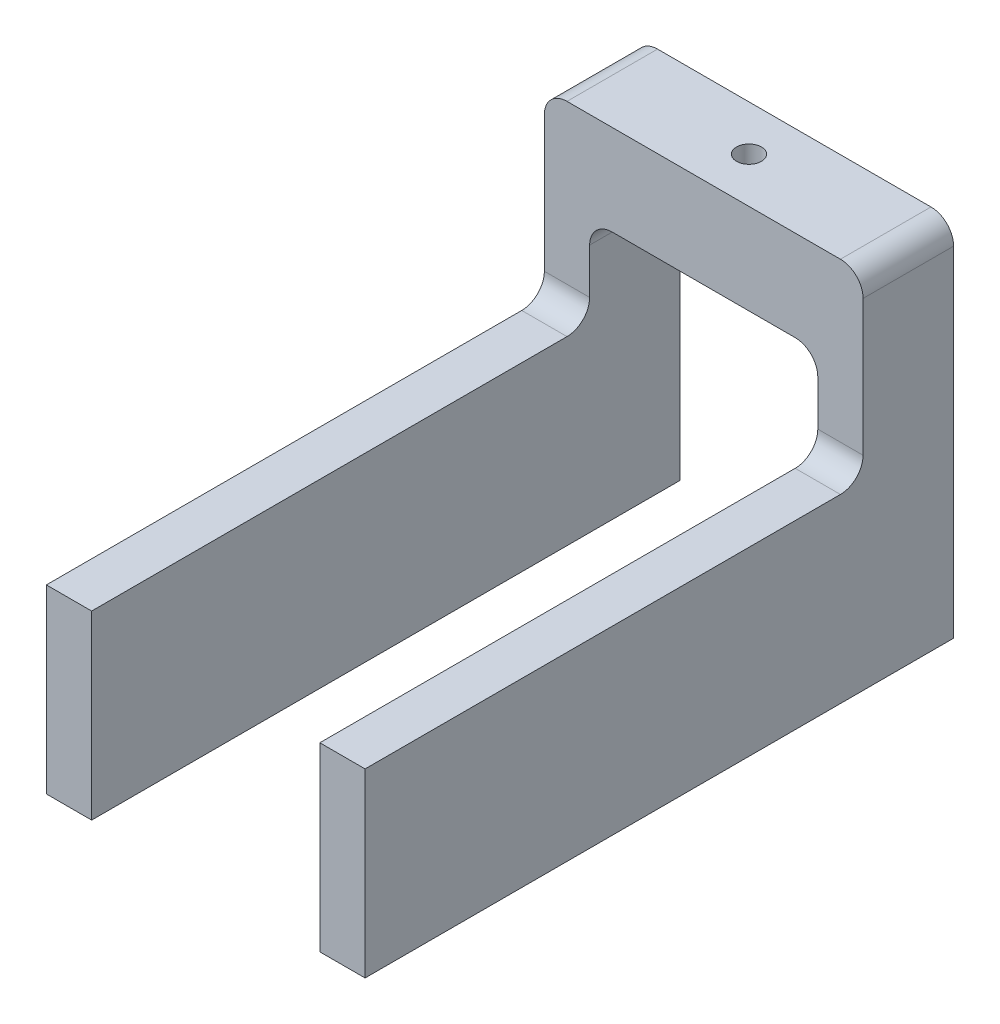
from build123d import *

# Parameters (mm, degrees)
BOSS_EXTRUDE1_DEPTH   = 89.408
SKETCH2_W             = 64.008
SKETCH2_H             = 76.2
CUT_EXTRUDE1_DEPTH    = 214.481522535
F_7_0MM_DOWEL_HOLE1_D = 7
FILLET1_R             = 6.35


with BuildPart() as part:
    # Sketch1 → Boss-Extrude1 (new body)
    with BuildSketch(Plane(origin=(0, 0, 0), x_dir=(0, 0, -1), z_dir=(1, 0, 0))):
        Polygon((0, 0), (-165.1, 0), (-165.1, 50.8), (-25.4, 50.8), (-25.4, 101.6), (0, 101.6), align=None)
    extrude(amount=BOSS_EXTRUDE1_DEPTH)

    # Sketch2 → Cut-Extrude1 (cut, through all)
    with BuildSketch(Plane(origin=(0, 0, 0), x_dir=(-1, 0, 0), z_dir=(0, 0, -1))):
        with Locations((-44.704, 38.1)):
            Rectangle(SKETCH2_W, SKETCH2_H)
    extrude(amount=-CUT_EXTRUDE1_DEPTH, mode=Mode.SUBTRACT)

    # Ø7.0mm Dowel Hole1 (through all)
    with Locations(Plane(origin=(0, 101.6, 0), x_dir=(1, 0, 0), z_dir=(0, 1, 0))):
        with Locations((44.704, -12.7)):
            Hole(F_7_0MM_DOWEL_HOLE1_D / 2)

    # Fillet1
    fillet1_edges = [part.edges().sort_by_distance(p)[0] for p in [
        (83.058, 50.8, 25.4),
        (6.35, 50.8, 25.4),
        (76.708, 76.2, 12.7),
        (12.7, 76.2, 12.7),
        (0, 101.6, 12.7),
        (89.408, 101.6, 12.7),
    ]]
    fillet(fillet1_edges, radius=FILLET1_R)


solid = part.part
